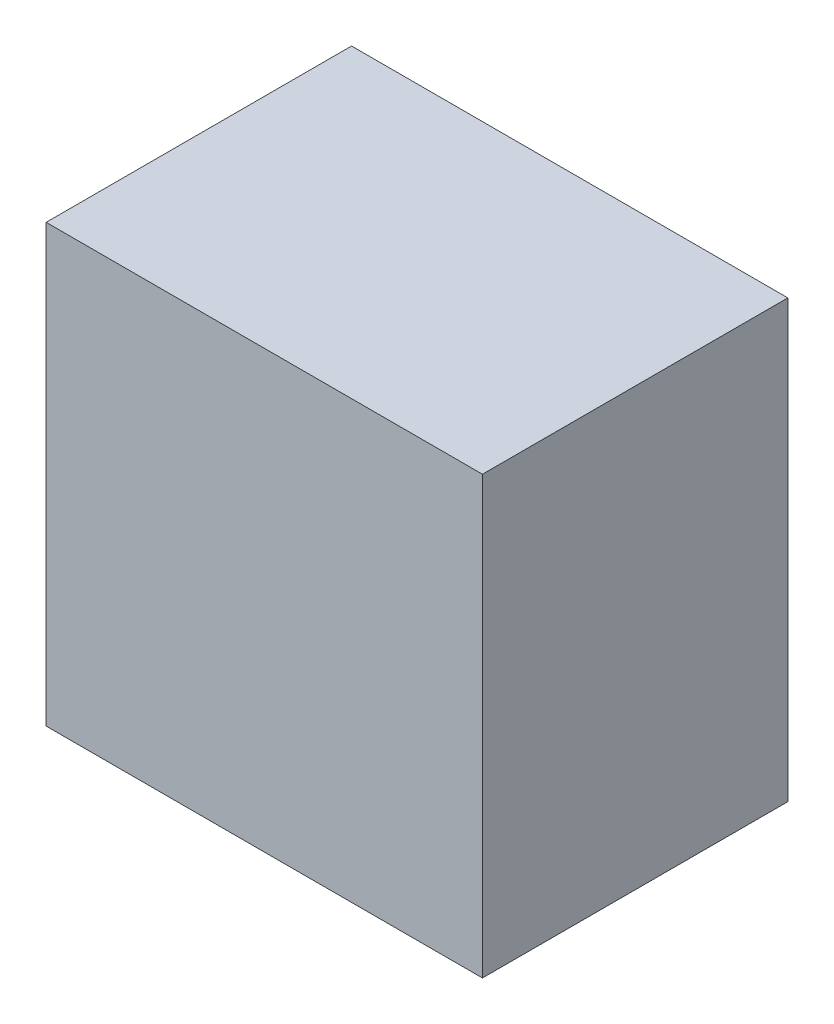
from build123d import *

# Parameters (mm, degrees)
SKETCH_1_W      = 10
SKETCH_1_H      = 10
EXTRUDE_1_DEPTH = 7


with BuildPart() as part:
    # 草图1 → 凸台-拉伸1 (new body)
    with BuildSketch(Plane.XY):
        Rectangle(SKETCH_1_W, SKETCH_1_H)
    extrude(amount=EXTRUDE_1_DEPTH)


solid = part.part
